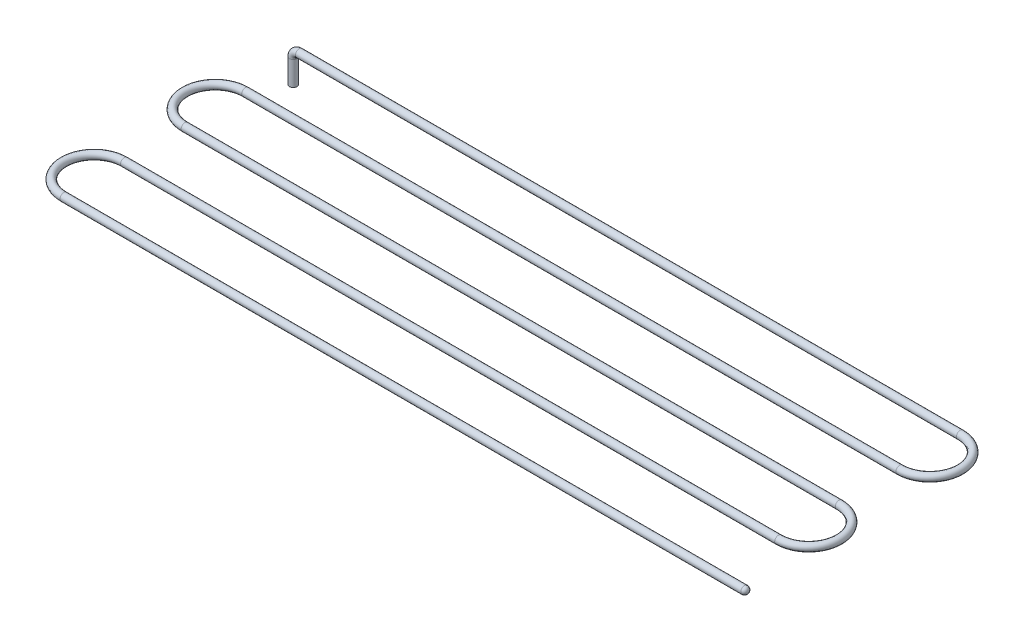
from build123d import *

# Parameters (mm, degrees)
ESQUISSE2_R = 2.5
CONG_1_R    = 2.4
ESQUISSE4_R = 2.5


with BuildPart() as part:
    # Balayage1: sweep along a path in Esquisse1
    with BuildLine(Plane(origin=(0, 0, 0), x_dir=(1, 0, 0), z_dir=(0, 1, 0))) as balayage1_path:
        Line((472, 0), (20, 0))
        ThreePointArc((20, 0), (0, 20), (20, 40))
        Line((20, 40), (452, 40))
        ThreePointArc((452, 40), (472, 60), (452, 80))
        Line((452, 80), (20, 80))
        ThreePointArc((20, 80), (0, 100), (20, 120))
        Line((20, 120), (452, 120))
        ThreePointArc((452, 120), (472, 140), (452, 160))
        Line((452, 160), (20, 160))
    # Esquisse2 → Balayage1 (sweep)
    with BuildSketch(Plane(origin=(472, 0, 0), x_dir=(0, 0, -1), z_dir=(1, 0, 0))):
        Circle(ESQUISSE2_R)
    sweep(path=balayage1_path.line)

    # Congé1
    cong_1_edges = [part.edges().sort_by_distance(p)[0] for p in [
        (472, 0, 2.5),
    ]]
    fillet(cong_1_edges, radius=CONG_1_R)

    # Balayage2: sweep along a path in Esquisse3
    with BuildLine(Plane.XY.offset(-160)) as balayage2_path:
        Line((20, 0), (15.5, 0))
        ThreePointArc((15.5, 0), (12.671572875, -1.171572875), (11.5, -4))
        Line((11.5, -4), (11.5, -20))
    # Esquisse4 → Balayage2 (sweep)
    with BuildSketch(Plane.ZY.offset(-20)):
        with Locations((-160, 0)):
            Circle(ESQUISSE4_R)
    sweep(path=balayage2_path.line)


solid = part.part
